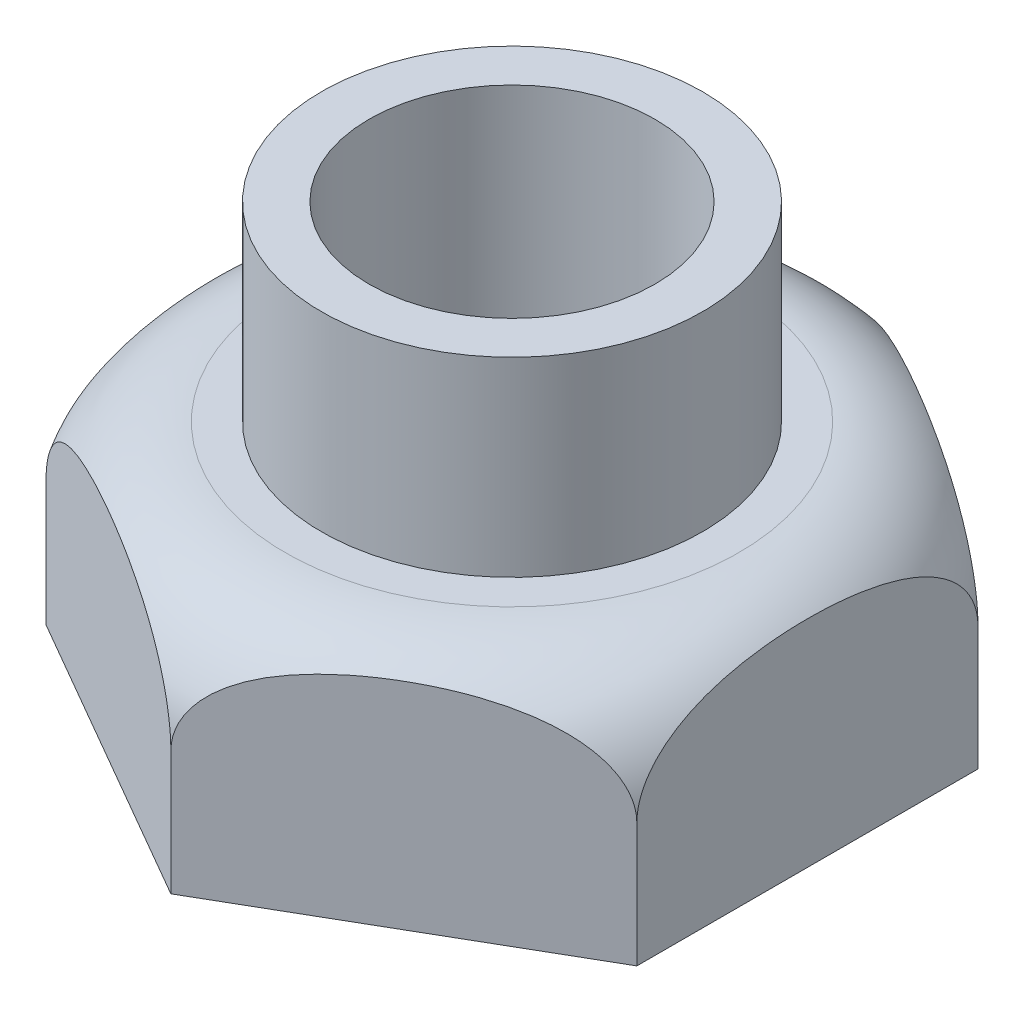
from build123d import *

# Parameters (mm, degrees)
BOSS_EXTRUDE1_DEPTH = 15.875
SKETCH3_R           = 12.7
BOSS_EXTRUDE2_DEPTH = 12.7
SKETCH4_R           = 9.525
CUT_EXTRUDE1_DEPTH  = 42.481266827


with BuildPart() as part:
    # Sketch1 → Boss-Extrude1 (new body)
    with BuildSketch(Plane(origin=(0, 0, 0), x_dir=(1, 0, 0), z_dir=(0, 1, 0))):
        Polygon((19.685, -11.365140049), (19.685, 11.365140049), (0, 22.730280098), (-19.685, 11.365140049), (-19.685, -11.365140049), (0, -22.730280098), align=None)
    extrude(amount=BOSS_EXTRUDE1_DEPTH)

    # Sketch2 → Cut-Revolve1 (revolve, cut)
    with BuildSketch(Plane(origin=(0, 0, 0), x_dir=(0, 0, -1), z_dir=(1, 0, 0))):
        with BuildLine():
            Line((22.730280098, 0), (28.475559527, 0))
            Line((28.475559527, 0), (28.475559527, 20.473836959))
            Line((28.475559527, 20.473836959), (11.365140049, 20.473836959))
            Line((11.365140049, 20.473836959), (11.365140049, 15.875))
            Line((11.365140049, 15.875), (15.110280098, 15.875))
            ThreePointArc((15.110280098, 15.875), (20.498433771, 13.643153673), (22.730280098, 8.255))
            Line((22.730280098, 8.255), (22.730280098, 0))
        make_face()
    revolve(axis=Axis((0, 0, 0), (0, 1, 0)), mode=Mode.SUBTRACT)

    # Sketch3 → Boss-Extrude2 (add)
    with BuildSketch(Plane(origin=(0, 15.875, 0), x_dir=(1, 0, 0), z_dir=(0, 1, 0))):
        with Locations(Location((0, 0, 0), (0, 0, 270))):
            Circle(SKETCH3_R)
    extrude(amount=BOSS_EXTRUDE2_DEPTH)

    # Sketch4 → Cut-Extrude1 (cut, through all)
    with BuildSketch(Plane(origin=(0, 28.575, 0), x_dir=(1, 0, 0), z_dir=(0, 1, 0))):
        with Locations(Location((0, 0, 0), (0, 0, 270))):
            Circle(SKETCH4_R)
    extrude(amount=-CUT_EXTRUDE1_DEPTH, mode=Mode.SUBTRACT)


solid = part.part
